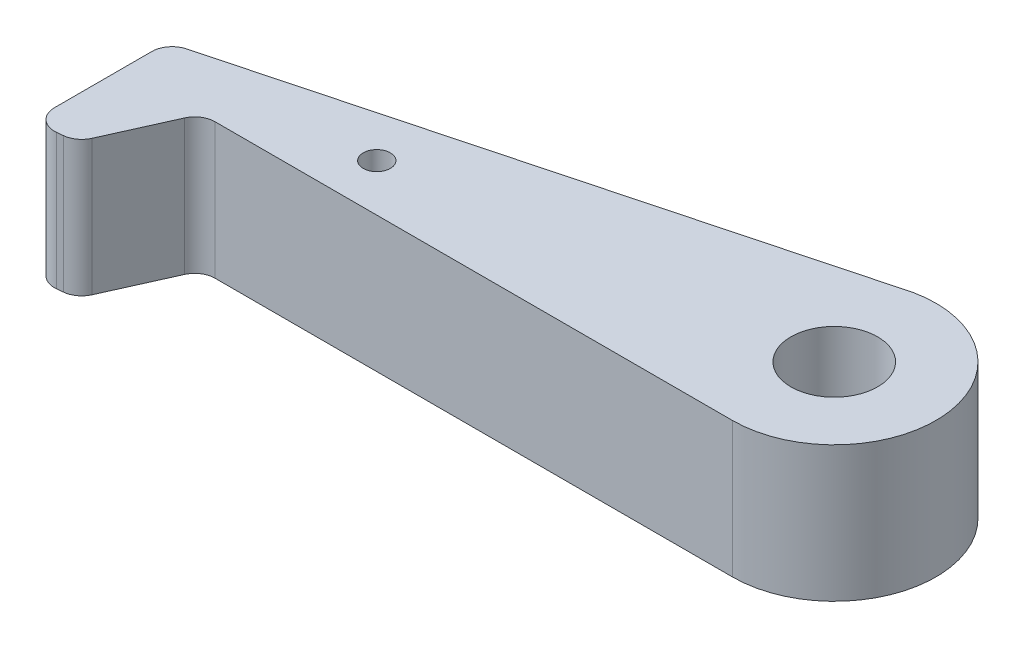
from build123d import *

# Parameters (mm, degrees)
SKETCH1_R           = 3.2
SKETCH1_R_2         = 1
BOSS_EXTRUDE1_DEPTH = 10
FILLET1_R           = 1.5


with BuildPart() as part:
    # Sketch1 → Boss-Extrude1 (new body)
    with BuildSketch(Plane(origin=(0, 0, 0), x_dir=(1, 0, 0), z_dir=(0, 1, 0))):
        with BuildLine():
            Line((0, 45), (43.494782903, 56.541397673))
            ThreePointArc((43.494782903, 56.541397673), (52.461753069, 49.950461527), (45, 41.69399531))
            Line((45, 41.69399531), (5.847258058, 41.69399531))
            Line((5.847258058, 41.69399531), (2.984330404, 35.306222204))
            Line((2.984330404, 35.306222204), (0, 35))
            Line((0, 35), (0, 45))
        make_face()
        with Locations(Location((45, 49.19399531, 0), (0, 0, 270))):
            Circle(SKETCH1_R, mode=Mode.SUBTRACT)
        with Locations(Location((15.270504009, 45.174409747, 0), (0, 0, 270))):
            Circle(SKETCH1_R_2, mode=Mode.SUBTRACT)
    extrude(amount=BOSS_EXTRUDE1_DEPTH)

    # Fillet1
    fillet1_edges = [part.edges().sort_by_distance(p)[0] for p in [
        (5.847258058, 5, -41.69399531),
        (2.984330404, 5, -35.306222204),
        (0, 5, -35),
        (0, 5, -45),
    ]]
    fillet(fillet1_edges, radius=FILLET1_R)


solid = part.part
